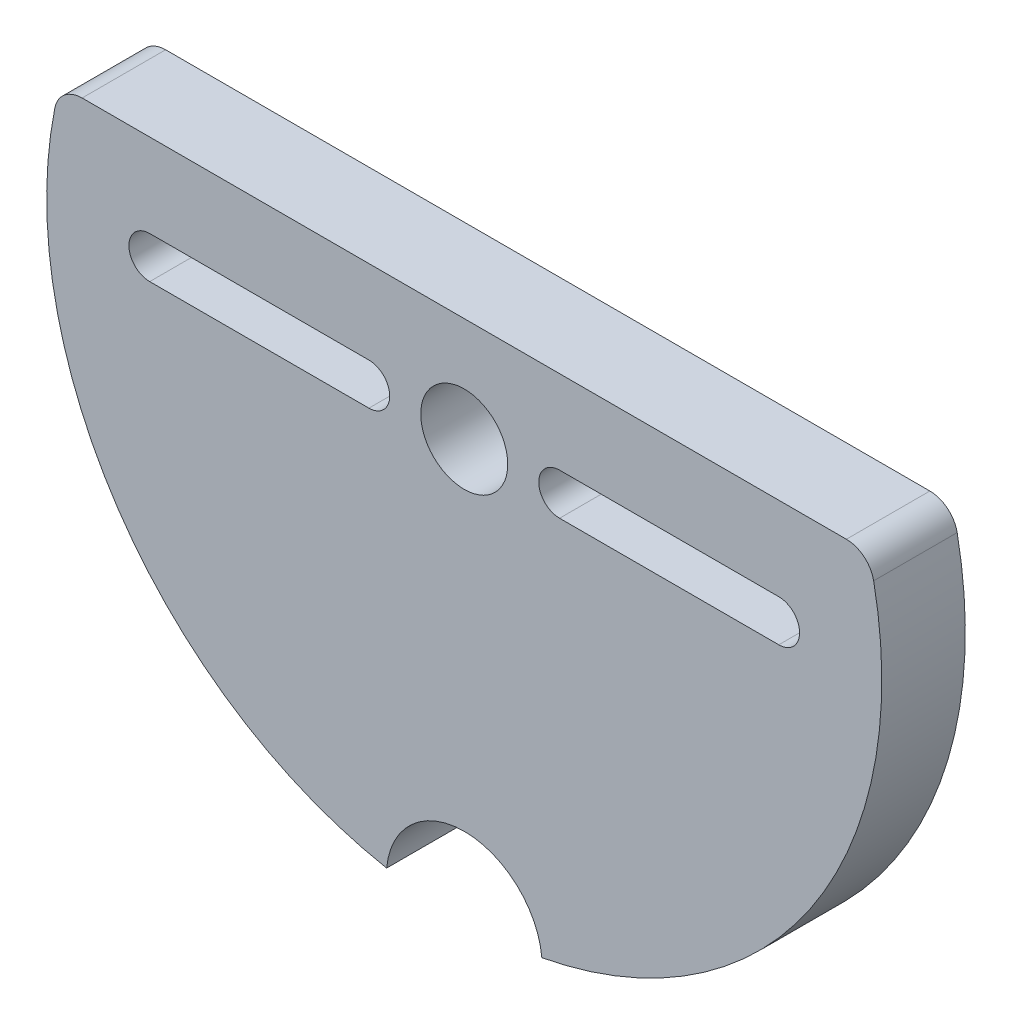
from build123d import *

# Parameters (mm, degrees)
BOSS_EXTRUDE1_DEPTH = 3.81
SKETCH4_R           = 1.984375
CUT_EXTRUDE2_DEPTH  = 27.977511323


with BuildPart() as part:
    # Sketch1 → Boss-Extrude1 (new body)
    with BuildSketch(Plane.XY):
        with BuildLine():
            Line((17.43361247, 4.7625), (-17.43361247, 4.7625))
            ThreePointArc((-17.43361247, 4.7625), (-18.238621898, 4.474772784), (-18.678870503, 3.741964286))
            ThreePointArc((-18.678870503, 3.741964286), (-15.796789426, -10.647250529), (-3.540477767, -18.718106667))
            ThreePointArc((-3.540477767, -18.718106667), (0, -15.494), (3.540477767, -18.718106667))
            ThreePointArc((3.540477767, -18.718106667), (15.796789426, -10.647250529), (18.678870503, 3.741964286))
            ThreePointArc((18.678870503, 3.741964286), (18.238621898, 4.474772784), (17.43361247, 4.7625))
        make_face()
    extrude(amount=BOSS_EXTRUDE1_DEPTH)

    # Sketch4 → Cut-Extrude2 (cut, through all)
    with BuildSketch(Plane.XY.offset(3.81)):
        Circle(SKETCH4_R)
        with BuildLine():
            Line((-14.350000002, 0.95), (-4.35, 0.95))
            ThreePointArc((-4.35, 0.95), (-3.4, 0), (-4.35, -0.95))
            Line((-4.35, -0.95), (-14.350000002, -0.95))
            ThreePointArc((-14.350000002, -0.95), (-15.300000002, 0), (-14.350000002, 0.95))
        make_face()
        with BuildLine():
            Line((4.35, 0.95), (14.350000002, 0.95))
            ThreePointArc((14.350000002, 0.95), (15.300000002, 0), (14.350000002, -0.95))
            Line((14.350000002, -0.95), (4.35, -0.95))
            ThreePointArc((4.35, -0.95), (3.4, 0), (4.35, 0.95))
        make_face()
    extrude(amount=-CUT_EXTRUDE2_DEPTH, mode=Mode.SUBTRACT)


solid = part.part
